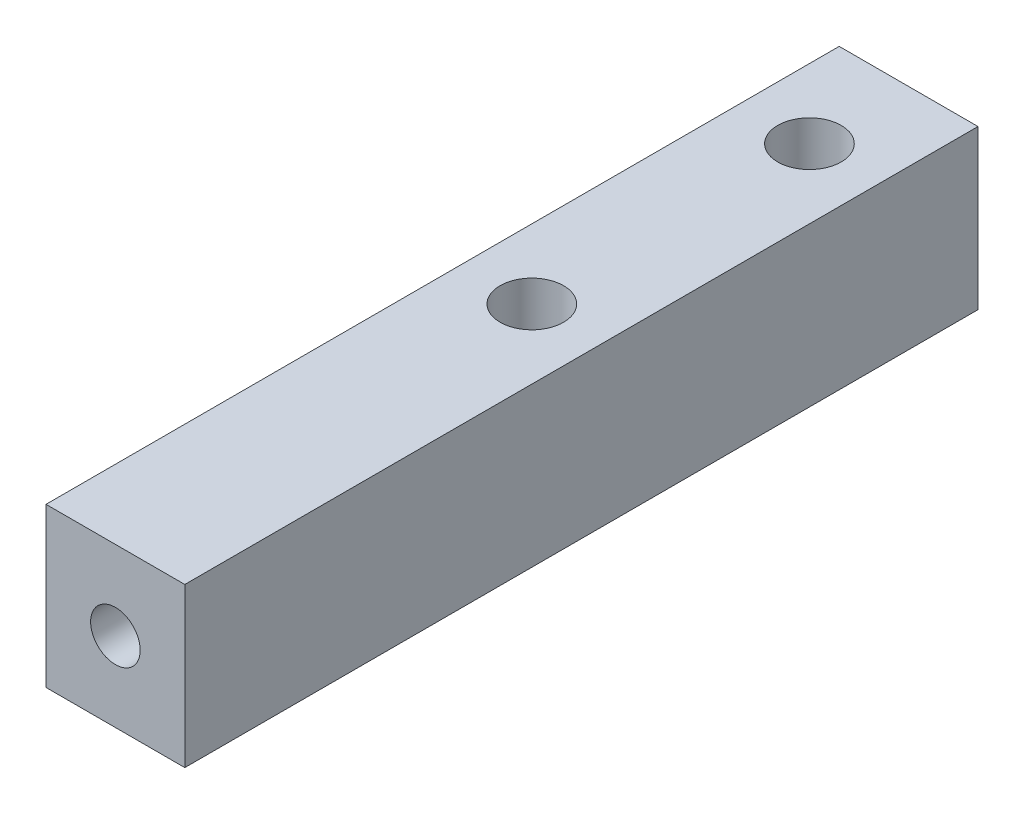
from build123d import *

# Parameters (mm, degrees)
ESQUISSE1_W                                   = 7
ESQUISSE1_H                                   = 8
BOSS_EXTRU_1_DEPTH                            = 40
TROU_POUR_TARAUDAGE_POUR_TROU_TARAUD_M3_D     = 2.5
TROU_POUR_TARAUDAGE_POUR_TROU_TARAUD_M3_DEPTH = 30
TROU_POUR_TARAUDAGE_POUR_TROU_TARAUD_M3_TIP   = 0.751075774
ESQUISSE4_R                                   = 1.6
ENL_V_MAT_EXTRU_1_DEPTH                       = 42.388404173


with BuildPart() as part:
    # Esquisse1 → Boss.-Extru.1 (new body)
    with BuildSketch(Plane.XY):
        with Locations((3.5, 4)):
            Rectangle(ESQUISSE1_W, ESQUISSE1_H)
    extrude(amount=BOSS_EXTRU_1_DEPTH)

    # Trou pour taraudage pour trou taraudé M31
    with Locations(Plane.XY.offset(40)):
        with Locations((3.5, 4)):
            Hole(TROU_POUR_TARAUDAGE_POUR_TROU_TARAUD_M3_D / 2, depth=TROU_POUR_TARAUDAGE_POUR_TROU_TARAUD_M3_DEPTH)
            with Locations((0, 0, -(TROU_POUR_TARAUDAGE_POUR_TROU_TARAUD_M3_DEPTH + TROU_POUR_TARAUDAGE_POUR_TROU_TARAUD_M3_TIP / 2))):  # 118° drill point
                Cone(0, TROU_POUR_TARAUDAGE_POUR_TROU_TARAUD_M3_D / 2, TROU_POUR_TARAUDAGE_POUR_TROU_TARAUD_M3_TIP, mode=Mode.SUBTRACT)

    # Esquisse4 → Enlèv. mat.-Extru.1 (cut, through all)
    with BuildSketch(Plane(origin=(0, 8, 0), x_dir=(1, 0, 0), z_dir=(0, 1, 0))):
        with Locations(Location((3.5, -5, 0), (0, 0, 270))):
            Circle(ESQUISSE4_R)
        with Locations(Location((3.5, -19, 0), (0, 0, 270))):
            Circle(ESQUISSE4_R)
    extrude(amount=-ENL_V_MAT_EXTRU_1_DEPTH, mode=Mode.SUBTRACT)


solid = part.part
